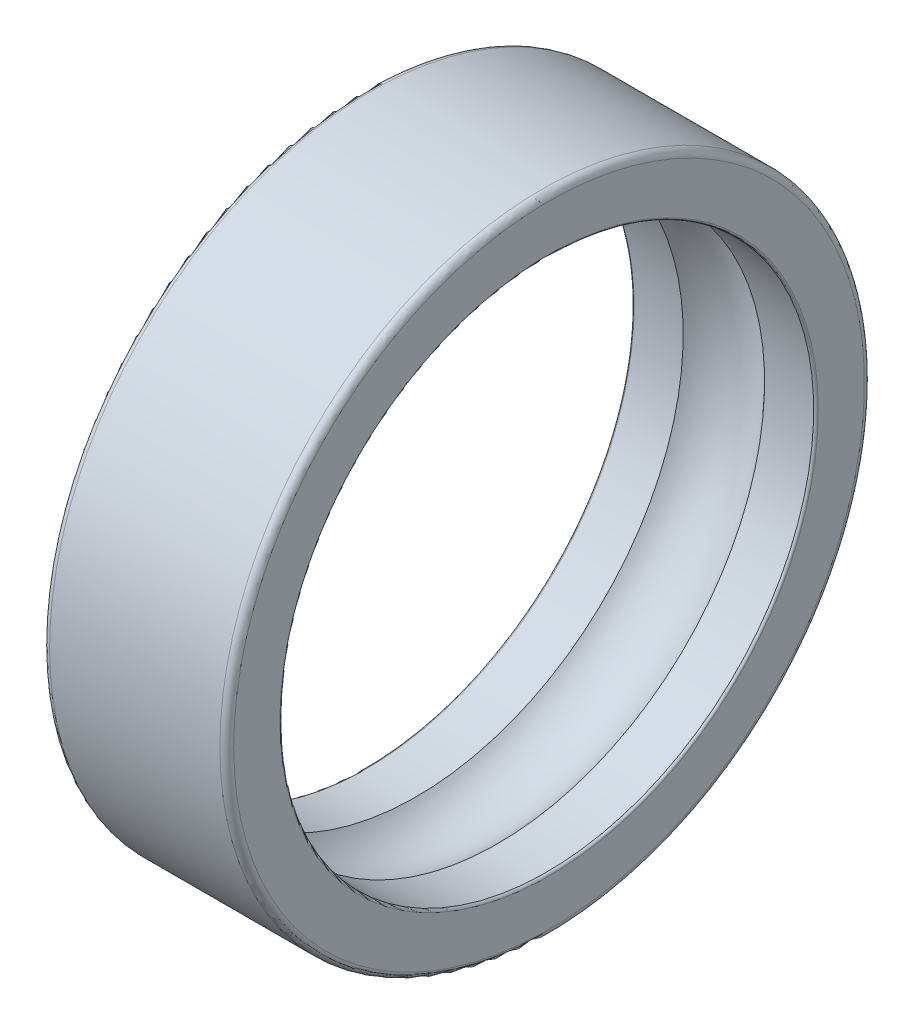
from build123d import *


with BuildPart() as part:
    # Esquisse1 → Révolution1 (revolve)
    with BuildSketch(Plane.XY, mode=Mode.PRIVATE) as r_volution1_sk:
        with BuildLine():
            Line((0, 13.7), (0, 11.695))
            ThreePointArc((0, 11.695), (0.029289322, 11.624289322), (0.1, 11.595))
            Line((0.1, 11.595), (2.232194581, 11.595))
            ThreePointArc((2.232194581, 11.595), (4, 12.381), (5.767805419, 11.595))
            Line((5.767805419, 11.595), (7.9, 11.595))
            ThreePointArc((7.9, 11.595), (7.970710678, 11.624289322), (8, 11.695))
            Line((8, 11.695), (8, 13.7))
            ThreePointArc((8, 13.7), (7.912132034, 13.912132034), (7.7, 14))
            Line((7.7, 14), (0.3, 14))
            ThreePointArc((0.3, 14), (0.087867966, 13.912132034), (0, 13.7))
        make_face()
    revolve(r_volution1_sk.sketch.rotate(Axis((50, 0, 0), (-1, 0, 0)), 270), axis=Axis((50, 0, 0), (-1, 0, 0)))


solid = part.part
